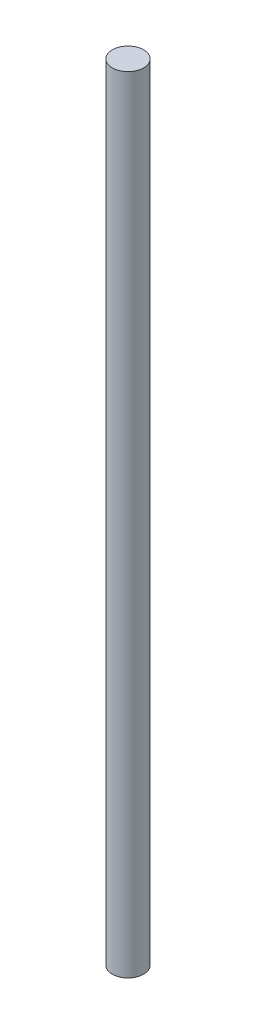
from build123d import *

# Parameters (mm, degrees)
SKETCH1_R           = 4
BOSS_EXTRUDE1_DEPTH = 200


with BuildPart() as part:
    # Sketch1 → Boss-Extrude1 (new body)
    with BuildSketch(Plane(origin=(0, 0, 0), x_dir=(1, 0, 0), z_dir=(0, 1, 0))):
        with Locations(Location((0, 0, 0), (0, 0, 270))):
            Circle(SKETCH1_R)
    extrude(amount=BOSS_EXTRUDE1_DEPTH)


solid = part.part
